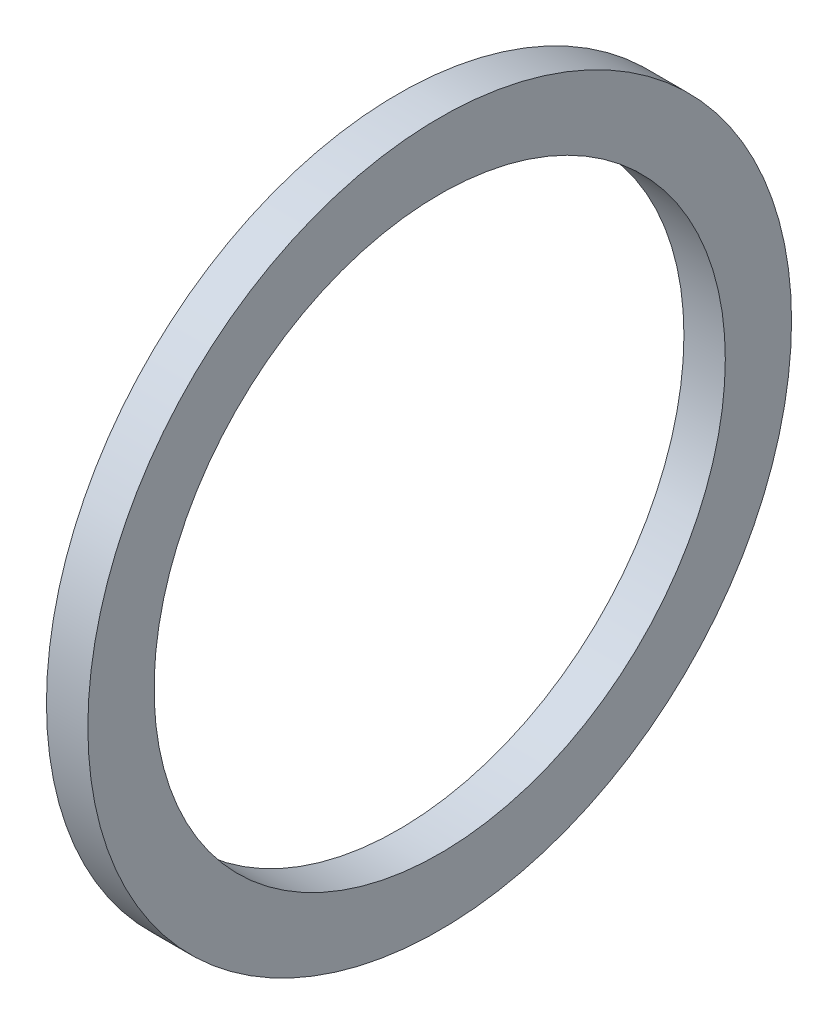
from build123d import *

# Parameters (mm, degrees)
SKETCH1_R           = 8.5
SKETCH1_R_2         = 6.9
BOSS_EXTRUDE1_DEPTH = 1


with BuildPart() as part:
    # Sketch1 → Boss-Extrude1 (new body)
    with BuildSketch(Plane(origin=(0, 0, 0), x_dir=(0, 0, -1), z_dir=(1, 0, 0))):
        Circle(SKETCH1_R)
        Circle(SKETCH1_R_2, mode=Mode.SUBTRACT)
    extrude(amount=BOSS_EXTRUDE1_DEPTH)


solid = part.part
